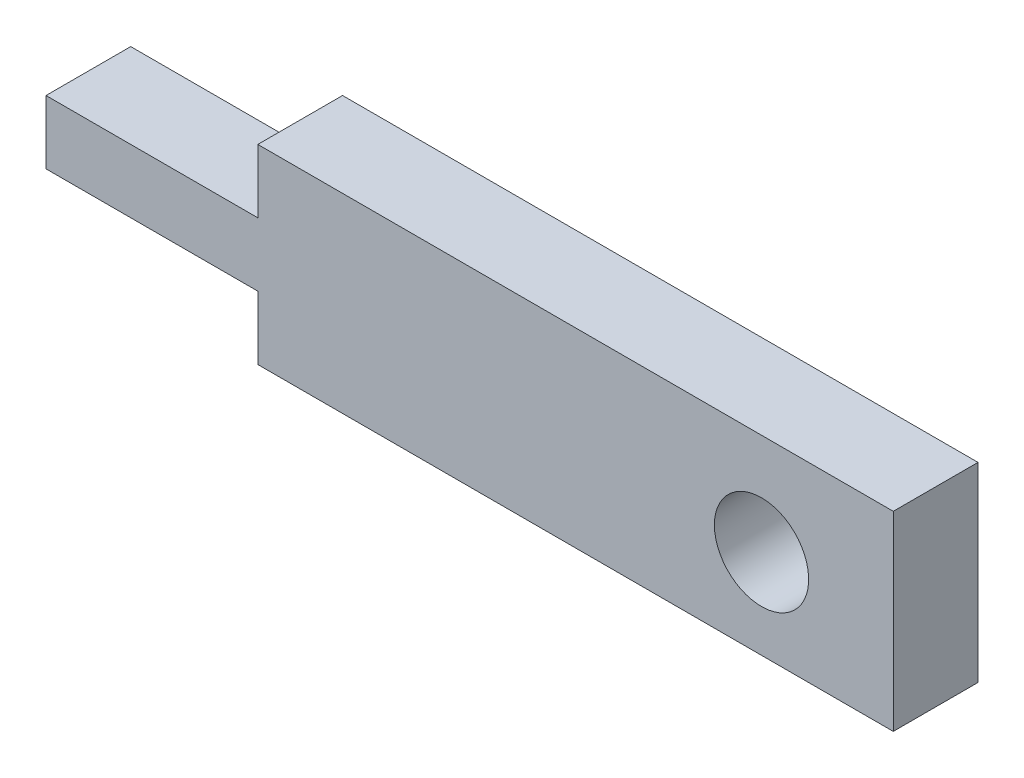
from build123d import *

# Parameters (mm, degrees)
CROQUIS1_W              = 350
CROQUIS1_H              = 20
SALIENTE_EXTRUIR1_DEPTH = 45
CROQUIS2_R              = 11.125
CORTAR_EXTRUIR1_DEPTH   = 182.796589627
CROQUIS3_R              = 11.125
CORTAR_EXTRUIR3_DEPTH   = 182.796589627


with BuildPart() as part:
    # Croquis1 → Saliente-Extruir1 (new body)
    with BuildSketch(Plane(origin=(0, 0, 0), x_dir=(1, 0, 0), z_dir=(0, 1, 0))):
        Rectangle(CROQUIS1_W, CROQUIS1_H)
    extrude(amount=SALIENTE_EXTRUIR1_DEPTH)

    # Croquis2 → Cortar-Extruir1 (cut, through all)
    with BuildSketch(Plane(origin=(0, 0, -10), x_dir=(-1, 0, 0), z_dir=(0, 0, -1))):
        with Locations((-143.9, 21.1)):
            Circle(CROQUIS2_R)
    cortar_extruir1 = extrude(amount=-CORTAR_EXTRUIR1_DEPTH, mode=Mode.SUBTRACT)

    # Simetría1: Cortar-Extruir1 across plane
    add(cortar_extruir1.mirror(Plane(origin=(0, 0, 0), x_dir=(0, 0, 1), z_dir=(1, 0, 0))), mode=Mode.SUBTRACT)

    # Croquis3 → Cortar-Extruir3 (cut, through all)
    with BuildSketch(Plane.XY.offset(10)):
        Polygon((-175, 0), (0, 0), (25, 0), (25, 15), (-25, 15), (-25, 30), (25, 30), (25, 45), (-175, 45), align=None)
        with Locations((-143.9, 21.1)):
            Circle(CROQUIS3_R, mode=Mode.SUBTRACT)
    extrude(amount=-CORTAR_EXTRUIR3_DEPTH, mode=Mode.SUBTRACT)


solid = part.part
